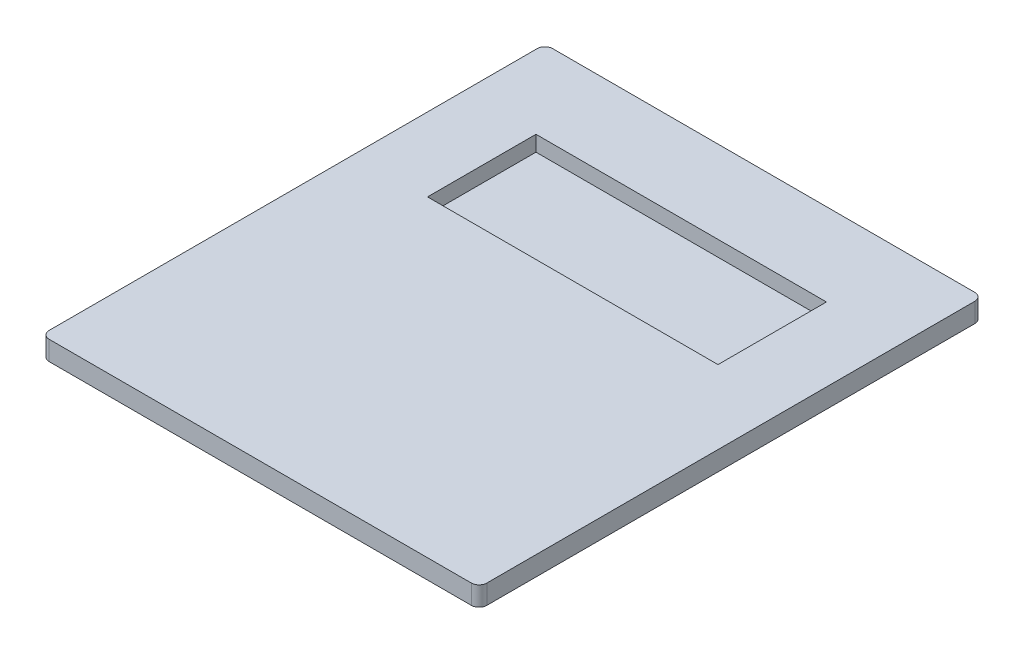
from build123d import *

# Parameters (mm, degrees)
SKETCH1_W           = 113
SKETCH1_H           = 130
BOSS_EXTRUDE1_DEPTH = 5
FILLET1_R           = 2
SKETCH3_W           = 75
SKETCH3_H           = 28
CUT_EXTRUDE1_DEPTH  = 4


with BuildPart() as part:
    # Sketch1 → Boss-Extrude1 (new body)
    with BuildSketch(Plane(origin=(0, 0, 0), x_dir=(1, 0, 0), z_dir=(0, 1, 0))):
        Rectangle(SKETCH1_W, SKETCH1_H)
    extrude(amount=BOSS_EXTRUDE1_DEPTH)

    # Fillet1
    fillet1_edges = [part.edges().sort_by_distance(p)[0] for p in [
        (56.5, 2.5, 65),
        (-56.5, 2.5, 65),
        (-56.5, 2.5, -65),
        (56.5, 2.5, -65),
    ]]
    fillet(fillet1_edges, radius=FILLET1_R)

    # Sketch3 → Cut-Extrude1 (cut)
    with BuildSketch(Plane(origin=(0, 5, 0), x_dir=(1, 0, 0), z_dir=(0, 1, 0))):
        with Locations((0, 29.689320388)):
            Rectangle(SKETCH3_W, SKETCH3_H)
    extrude(amount=-CUT_EXTRUDE1_DEPTH, mode=Mode.SUBTRACT)


solid = part.part
